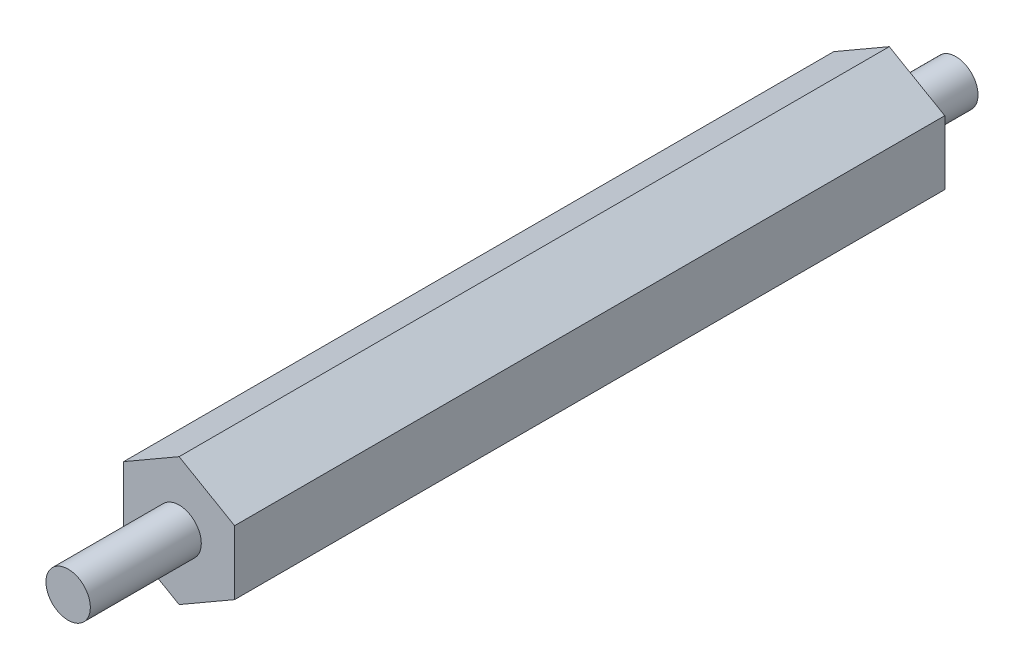
from build123d import *

# Parameters (mm, degrees)
ESTRUSIONE_ESTRUSIONE1_DEPTH = 32
SCHIZZO2_R                   = 1
ESTRUSIONE_ESTRUSIONE2_DEPTH = 5
ESTRUSIONE_ESTRUSIONE3_START = 3
SCHIZZO4_R                   = 1
ESTRUSIONE_ESTRUSIONE3_DEPTH = 3


with BuildPart() as part:
    # Schizzo1 → Estrusione-Estrusione1 (new body)
    with BuildSketch(Plane.XY):
        Polygon((0, -16.964772049), (-2.5, -18.408147722), (-2.5, -21.294899068), (0, -22.738274741), (2.5, -21.294899068), (2.5, -18.408147722), align=None)
    extrude(amount=ESTRUSIONE_ESTRUSIONE1_DEPTH)

    # Schizzo2 → Estrusione-Estrusione2 (add)
    with BuildSketch(Plane.XY.offset(32)):
        with Locations((0, -19.851523395)):
            Circle(SCHIZZO2_R)
    extrude(amount=ESTRUSIONE_ESTRUSIONE2_DEPTH)

    # Schizzo4 → Estrusione-Estrusione3 (add)
    with BuildSketch(Plane(origin=(0, 0, 0), x_dir=(-1, 0, 0), z_dir=(0, 0, -1)).offset(ESTRUSIONE_ESTRUSIONE3_START)):
        with Locations(Location((0, -19.851523395, 0), (0, 0, 180))):
            Circle(SCHIZZO4_R)
    extrude(amount=-ESTRUSIONE_ESTRUSIONE3_DEPTH)


solid = part.part
